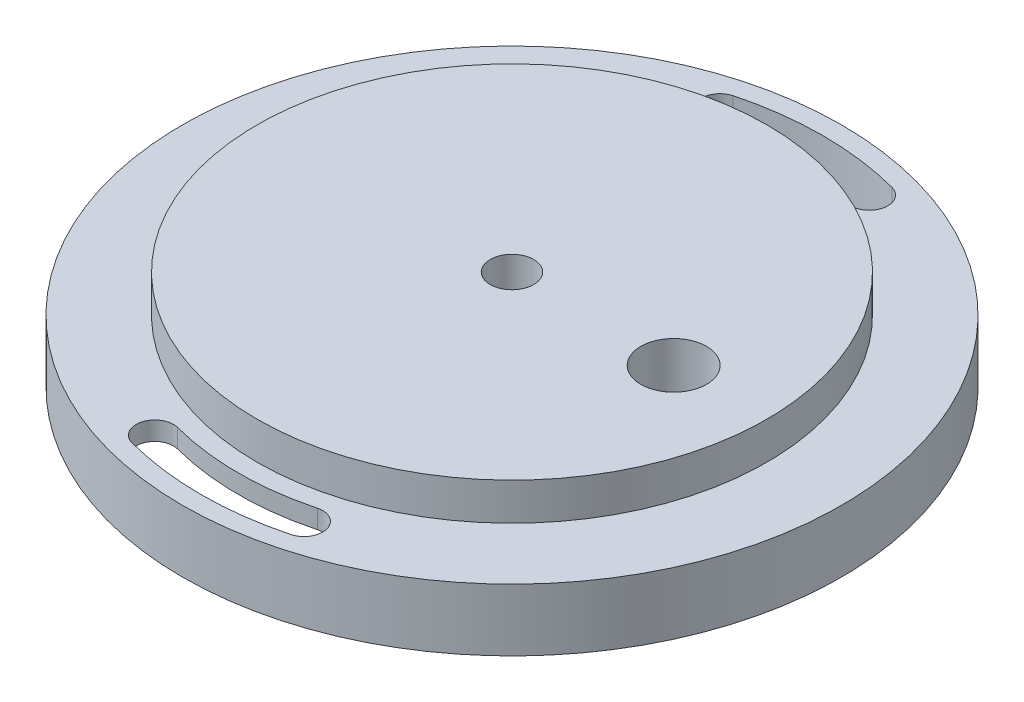
from build123d import *

# Parameters (mm, degrees)
SKETCH_3_W          = 2.645592797
SKETCH_3_H          = 5.492550126
CUT_EXTRUDE_START   = -20
CUT_EXTRUDE_2_DEPTH = 20
CUT_EXTRUDE_START_2 = -10
CUT_EXTRUDE_1_DEPTH = 10


with BuildPart() as part:
    # Эскиз1 → Повернуть1 (revolve)
    with BuildSketch(Plane.XY, mode=Mode.PRIVATE) as revolve_1_sk:
        Polygon((-26.5, 30.6), (-26.5, 35.6), (-20.5, 35.6), (-20.5, 38.6), (-1.75, 38.6), (-1.75, 34.1), (-24.523884272, 34.1), (-25, 34.1), (-25, 30.6), align=None)
    revolve(revolve_1_sk.sketch.rotate(Axis((0, 29.900525332, 0), (0, 1, 0)), 270), axis=Axis((0, 29.900525332, 0), (0, 1, 0)))

    # Эскиз3 → Вырез-Повернуть1 (revolve, cut)
    with BuildSketch(Plane.XY, mode=Mode.PRIVATE) as cut_revolve_1_sk:
        with Locations((11.677203602, 35.853724937)):
            Rectangle(SKETCH_3_W, SKETCH_3_H)
    revolve(cut_revolve_1_sk.sketch.rotate(Axis((13, 30.6, 0), (0, 1, 0)), 180), axis=Axis((13, 30.6, 0), (0, 1, 0)), mode=Mode.SUBTRACT)

    # Эскиз5 → Вырез-Вытянуть2 (cut)
    with BuildSketch(Plane(origin=(0, 35.6, 0), x_dir=(1, 0, 0), z_dir=(0, 1, 0)).offset(CUT_EXTRUDE_START)):
        with BuildLine():
            ThreePointArc((-5.617021277, -21.270850288), (-7.450285247, -22.338156812), (-6.382978723, -24.171420782))
            ThreePointArc((-6.382978723, -24.171420782), (0, -25), (6.382978723, -24.171420782))
            ThreePointArc((6.382978723, -24.171420782), (7.450285247, -22.338156812), (5.617021277, -21.270850288))
            ThreePointArc((5.617021277, -21.270850288), (0, -22), (-5.617021277, -21.270850288))
        make_face()
        with BuildLine():
            ThreePointArc((6.382978723, 24.171420782), (7.450285247, 22.338156812), (5.617021277, 21.270850288))
            ThreePointArc((5.617021277, 21.270850288), (0, 22), (-5.617021277, 21.270850288))
            ThreePointArc((-5.617021277, 21.270850288), (-7.450285247, 22.338156812), (-6.382978723, 24.171420782))
            ThreePointArc((-6.382978723, 24.171420782), (0, 25), (6.382978723, 24.171420782))
        make_face()
    extrude(amount=CUT_EXTRUDE_2_DEPTH, mode=Mode.SUBTRACT)

    # Эскиз4 → Вырез-Вытянуть1 (cut)
    with BuildSketch(Plane(origin=(0, 35.6, 0), x_dir=(1, 0, 0), z_dir=(0, 1, 0)).offset(CUT_EXTRUDE_START_2)):
        with BuildLine():
            ThreePointArc((-5.617021277, -21.270850288), (0, -22), (5.617021277, -21.270850288))
            ThreePointArc((5.617021277, -21.270850288), (7.450285247, -22.338156812), (6.382978723, -24.171420782))
            ThreePointArc((6.382978723, -24.171420782), (0, -25), (-6.382978723, -24.171420782))
            ThreePointArc((-6.382978723, -24.171420782), (-7.450285247, -22.338156812), (-5.617021277, -21.270850288))
        make_face()
        with BuildLine():
            ThreePointArc((6.382978723, 24.171420782), (7.450285247, 22.338156812), (5.617021277, 21.270850288))
            ThreePointArc((5.617021277, 21.270850288), (0, 22), (-5.617021277, 21.270850288))
            ThreePointArc((-5.617021277, 21.270850288), (-7.450285247, 22.338156812), (-6.382978723, 24.171420782))
            ThreePointArc((-6.382978723, 24.171420782), (0, 25), (6.382978723, 24.171420782))
        make_face()
    extrude(amount=CUT_EXTRUDE_1_DEPTH, mode=Mode.SUBTRACT)


solid = part.part
